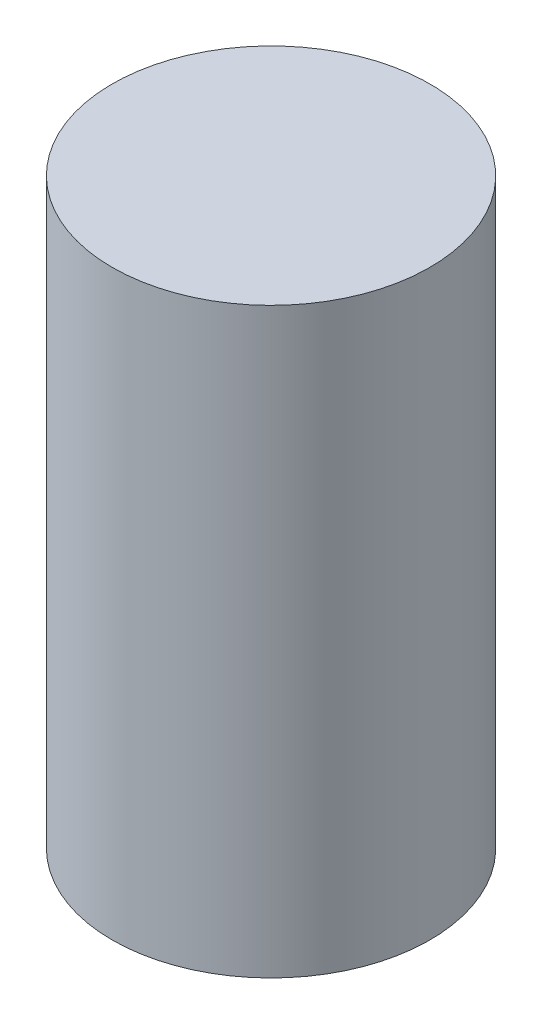
from build123d import *

# Parameters (mm, degrees)
EXTRUDE_1_DEPTH      = 1000
EXTRUDE_1_DEPTH_BACK = 100
SKETCH_2_R           = 300


with BuildPart() as part:
    # 草图2 → 凸台-拉伸1 (new, two sides: drawn at the far end of the back side and taken through both)
    with BuildSketch(Plane(origin=(0, 0, 0), x_dir=(1, 0, 0), z_dir=(0, 1, 0)).offset(-EXTRUDE_1_DEPTH_BACK)):
        with Locations(Location((0, 0, 0), (0, 0, 270))):
            Circle(SKETCH_2_R)
    extrude(amount=EXTRUDE_1_DEPTH + EXTRUDE_1_DEPTH_BACK)


solid = part.part
